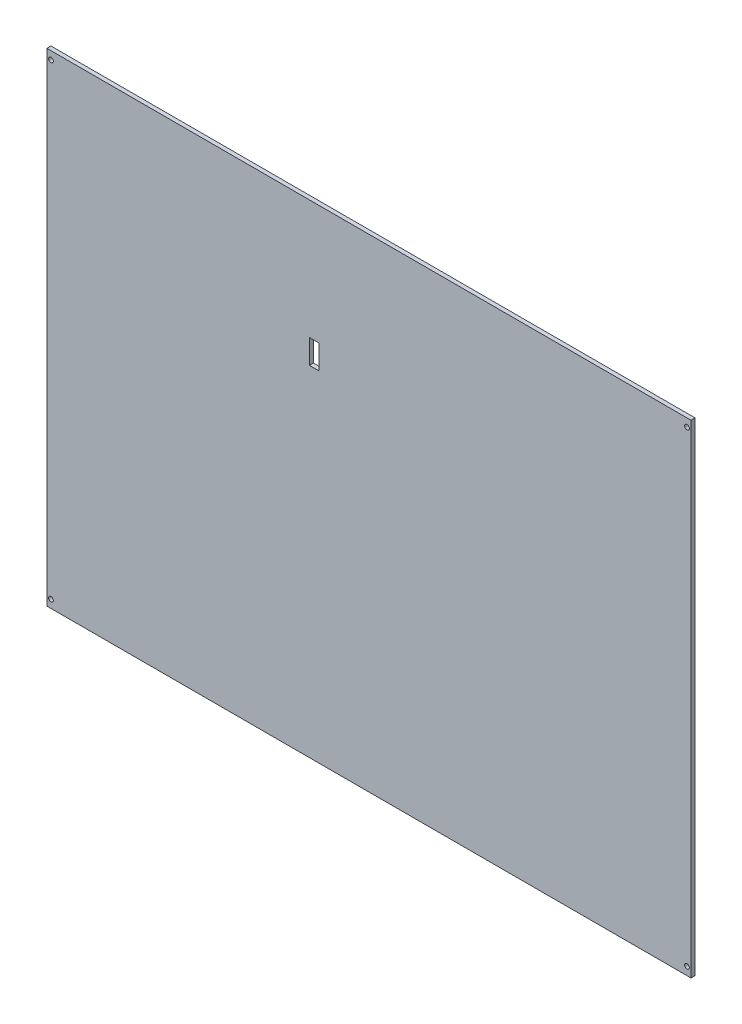
from build123d import *

# Parameters (mm, degrees)
SKETCH1_W           = 508
SKETCH1_H           = 381
BOSS_EXTRUDE1_DEPTH = 3.175
SKETCH2_R           = 1.8542
CUT_EXTRUDE1_DEPTH  = 3.175
SKETCH3_W           = 7.62
SKETCH3_H           = 19.05
CUT_EXTRUDE2_DEPTH  = 3.175


with BuildPart() as part:
    # Sketch1 → Boss-Extrude1 (new body)
    with BuildSketch(Plane.XY):
        Rectangle(SKETCH1_W, SKETCH1_H)
    extrude(amount=BOSS_EXTRUDE1_DEPTH)

    # Sketch2 → Cut-Extrude1 (cut)
    with BuildSketch(Plane.XY.offset(3.175)):
        with Locations((-250.825, -184.15)):
            Circle(SKETCH2_R)
        with Locations((-250.825, 184.15)):
            Circle(SKETCH2_R)
        with Locations((250.825, 184.15)):
            Circle(SKETCH2_R)
        with Locations((250.825, -184.15)):
            Circle(SKETCH2_R)
    extrude(amount=-CUT_EXTRUDE1_DEPTH, mode=Mode.SUBTRACT)

    # Sketch3 → Cut-Extrude2 (cut)
    with BuildSketch(Plane.XY.offset(3.175)):
        with Locations((-43.18, 86.995)):
            Rectangle(SKETCH3_W, SKETCH3_H)
    extrude(amount=-CUT_EXTRUDE2_DEPTH, mode=Mode.SUBTRACT)


solid = part.part
